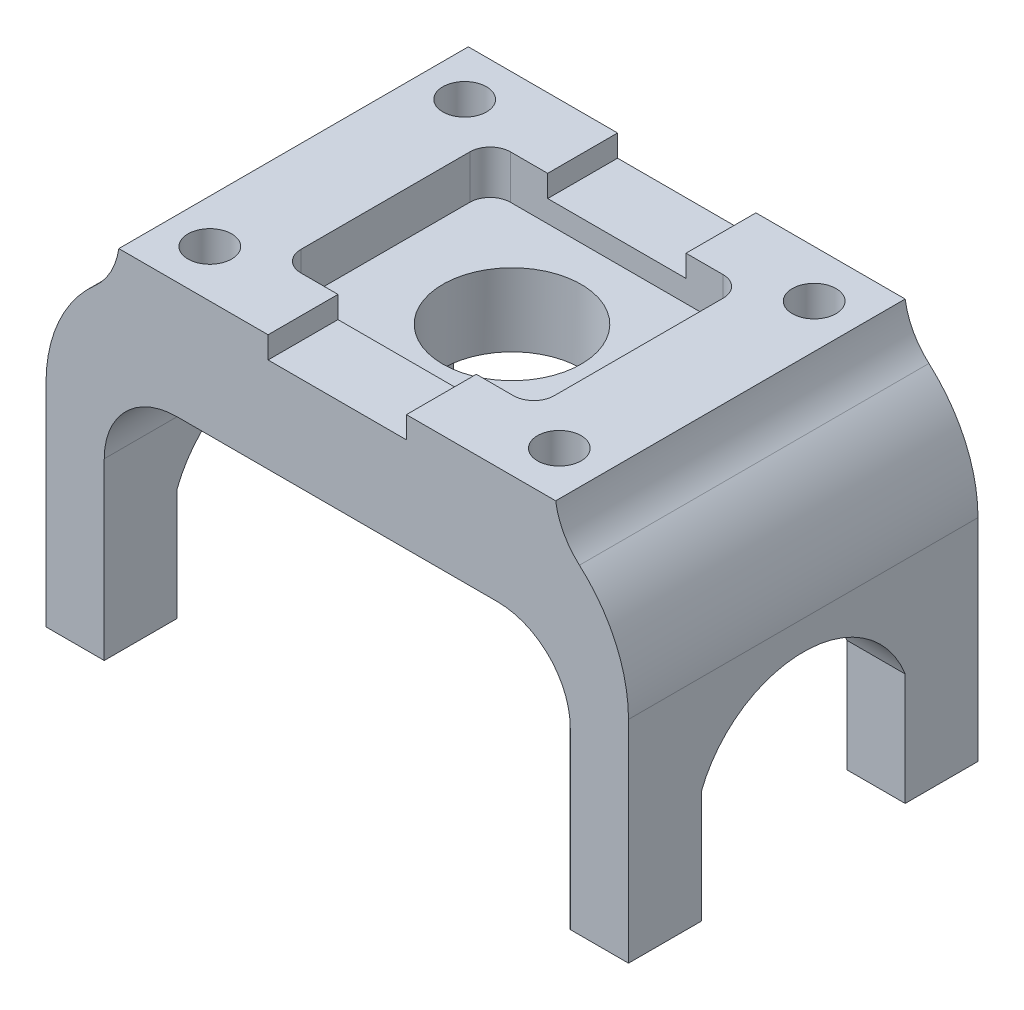
from build123d import *

# Parameters (mm, degrees)
BOSS_EXTRUDE1_DEPTH     = 60.96
CUT_EXTRUDE1_DEPTH      = 3.81
CUT_EXTRUDE1_DEPTH_BACK = 3.81
SKETCH4_W               = 44.196
SKETCH4_H               = 36.576
SKETCH6_R               = 12.065
SKETCH6_R_2             = 3.81
CUT_EXTRUDE2_DEPTH      = 40.64
CUT_EXTRUDE4_DEPTH      = 126.82636128
CUT_EXTRUDE4_DEPTH_BACK = 126.82636128
FILLET1_R               = 3.556


with BuildPart() as part:
    # Sketch2 → Boss-Extrude1 (new body)
    with BuildSketch(Plane.XY):
        with BuildLine():
            Line((-35.382985005, -21.149184515), (-35.382985005, 15.680815485))
            ThreePointArc((-35.382985005, 15.680815485), (-33.145202484, 26.105386529), (-26.826159694, 34.693113252))
            ThreePointArc((-26.826159694, 34.693113252), (-24.077840328, 38.155820727), (-22.682985005, 42.350815485))
            Line((-22.682985005, 42.350815485), (3.352014995, 42.350815485))
            Line((3.352014995, 42.350815485), (3.352014995, 38.540815485))
            Line((3.352014995, 38.540815485), (27.482014995, 38.540815485))
            Line((27.482014995, 38.540815485), (27.482014995, 42.350815485))
            Line((27.482014995, 42.350815485), (53.517014995, 42.350815485))
            ThreePointArc((53.517014995, 42.350815485), (54.911870318, 38.155820727), (57.660189685, 34.693113252))
            ThreePointArc((57.660189685, 34.693113252), (63.979232475, 26.105386529), (66.217014995, 15.680815485))
            Line((66.217014995, 15.680815485), (66.217014995, -21.149184515))
            Line((66.217014995, -21.149184515), (56.057014995, -21.149184515))
            Line((56.057014995, -21.149184515), (56.057014995, 9.330815485))
            ThreePointArc((56.057014995, 9.330815485), (52.337271116, 18.311071606), (43.357014995, 22.030815485))
            Line((43.357014995, 22.030815485), (-12.522985005, 22.030815485))
            ThreePointArc((-12.522985005, 22.030815485), (-21.503241126, 18.311071606), (-25.222985005, 9.330815485))
            Line((-25.222985005, 9.330815485), (-25.222985005, -21.149184515))
            Line((-25.222985005, -21.149184515), (-35.382985005, -21.149184515))
        make_face()
    extrude(amount=-BOSS_EXTRUDE1_DEPTH)

    # Sketch4 → Cut-Extrude1 (cut, two sides: drawn at the far end of the back side and taken through both)
    with BuildSketch(Plane(origin=(0, 38.540815485, 0), x_dir=(1, 0, 0), z_dir=(0, 1, 0)).offset(-CUT_EXTRUDE1_DEPTH_BACK)):
        with Locations((15.417014995, 30.48)):
            Rectangle(SKETCH4_W, SKETCH4_H)
    extrude(amount=CUT_EXTRUDE1_DEPTH + CUT_EXTRUDE1_DEPTH_BACK, mode=Mode.SUBTRACT)

    # Sketch6 → Cut-Extrude2 (cut)
    with BuildSketch(Plane(origin=(0, 42.350815485, 0), x_dir=(1, 0, 0), z_dir=(0, 1, 0))):
        with Locations(Location((15.417014995, 30.48, 0), (0, 0, 270))):
            Circle(SKETCH6_R)
        with Locations(Location((-15.062985005, 8.255, 0), (0, 0, 270))):
            Circle(SKETCH6_R_2)
        with Locations(Location((-15.062985005, 52.705, 0), (0, 0, 270))):
            Circle(SKETCH6_R_2)
        with Locations(Location((45.897014995, 52.705, 0), (0, 0, 270))):
            Circle(SKETCH6_R_2)
        with Locations(Location((45.897014995, 8.255, 0), (0, 0, 270))):
            Circle(SKETCH6_R_2)
    extrude(amount=-CUT_EXTRUDE2_DEPTH, mode=Mode.SUBTRACT)

    # Sketch7 → Cut-Extrude4 (cut, two sides: drawn at the far end of the back side and taken through both)
    with BuildSketch(Plane(origin=(66.217014995, 0, 0), x_dir=(0, 0, -1), z_dir=(1, 0, 0)).offset(-CUT_EXTRUDE4_DEPTH_BACK)):
        with BuildLine():
            Line((12.7, -1.591184515), (12.7, -21.149184515))
            Line((12.7, -21.149184515), (48.26, -21.149184515))
            Line((48.26, -21.149184515), (48.26, -1.591184515))
            ThreePointArc((48.26, -1.591184515), (30.48, 10.61965618), (12.7, -1.591184515))
        make_face()
    extrude(amount=CUT_EXTRUDE4_DEPTH + CUT_EXTRUDE4_DEPTH_BACK, mode=Mode.SUBTRACT)

    # Fillet1
    fillet1_edges = [part.edges().sort_by_distance(p)[0] for p in [
        (37.515014995, 38.540815485, -12.192),
        (37.515014995, 38.540815485, -48.768),
        (-6.680985005, 38.540815485, -48.768),
        (-6.680985005, 38.540815485, -12.192),
    ]]
    fillet(fillet1_edges, radius=FILLET1_R)


solid = part.part
